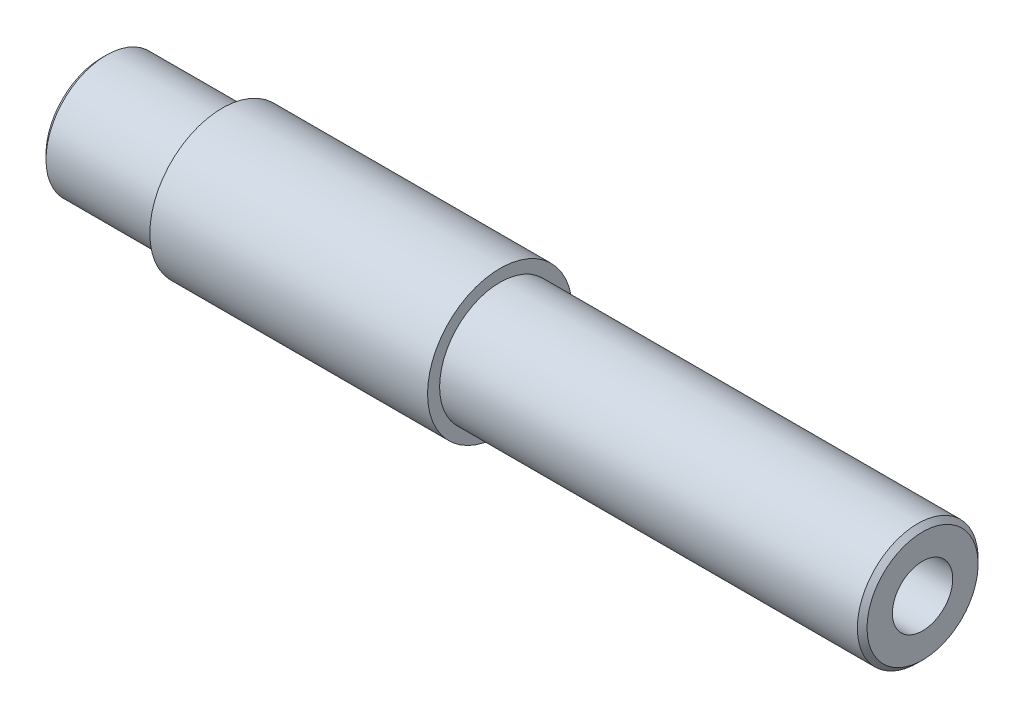
from build123d import *

# Parameters (mm, degrees)
TROU_TARAUD_M31_D     = 2.5
TROU_TARAUD_M31_DEPTH = 8
TROU_TARAUD_M31_TIP   = 0.751075774
ESQUISSE7_W           = 5
ESQUISSE7_H           = 0.5
CHANFREIN1_SIZE       = 0.2
TROU_TARAUD_M32_D     = 2.5
TROU_TARAUD_M32_DEPTH = 8
TROU_TARAUD_M32_TIP   = 0.751075774


with BuildPart() as part:
    # Esquisse2 → Révolution1 (revolve)
    with BuildSketch(Plane.XY, mode=Mode.PRIVATE) as r_volution1_sk:
        Polygon((17, 0), (17, 2.5), (-0.5, 2.5), (-0.5, 3), (-17, 3), (-17, 0), align=None)
    revolve(r_volution1_sk.sketch.rotate(Axis((-17, 0, 0), (1, 0, 0)), 90), axis=Axis((-17, 0, 0), (1, 0, 0)))

    # Trou taraudé M31
    with Locations(Plane(origin=(17, 0, 0), x_dir=(0, 0, -1), z_dir=(1, 0, 0))):
        with Locations((0, 0)):
            Hole(TROU_TARAUD_M31_D / 2, depth=TROU_TARAUD_M31_DEPTH)
            with Locations((0, 0, -(TROU_TARAUD_M31_DEPTH + TROU_TARAUD_M31_TIP / 2))):  # 118° drill point
                Cone(0, TROU_TARAUD_M31_D / 2, TROU_TARAUD_M31_TIP, mode=Mode.SUBTRACT)

    # Esquisse7 → Enlèvement de matière-Révolution1 (revolve, cut)
    with BuildSketch(Plane.XY, mode=Mode.PRIVATE) as enl_vement_de_mati_re_r_volution1_sk:
        with Locations((-14.5, 2.75)):
            Rectangle(ESQUISSE7_W, ESQUISSE7_H)
    revolve(enl_vement_de_mati_re_r_volution1_sk.sketch.rotate(Axis((-17, 0, 0), (1, 0, 0)), 90), axis=Axis((-17, 0, 0), (1, 0, 0)), mode=Mode.SUBTRACT)

    # Chanfrein1
    chanfrein1_edges = [part.edges().sort_by_distance(p)[0] for p in [
        (-17, 0, -2.5),
        (17, 0, -2.5),
    ]]
    chamfer(chanfrein1_edges, length=CHANFREIN1_SIZE)

    # Trou taraudé M32
    with Locations(Plane.ZY.offset(17)):
        with Locations((0, 0)):
            Hole(TROU_TARAUD_M32_D / 2, depth=TROU_TARAUD_M32_DEPTH)
            with Locations((0, 0, -(TROU_TARAUD_M32_DEPTH + TROU_TARAUD_M32_TIP / 2))):  # 118° drill point
                Cone(0, TROU_TARAUD_M32_D / 2, TROU_TARAUD_M32_TIP, mode=Mode.SUBTRACT)


solid = part.part
